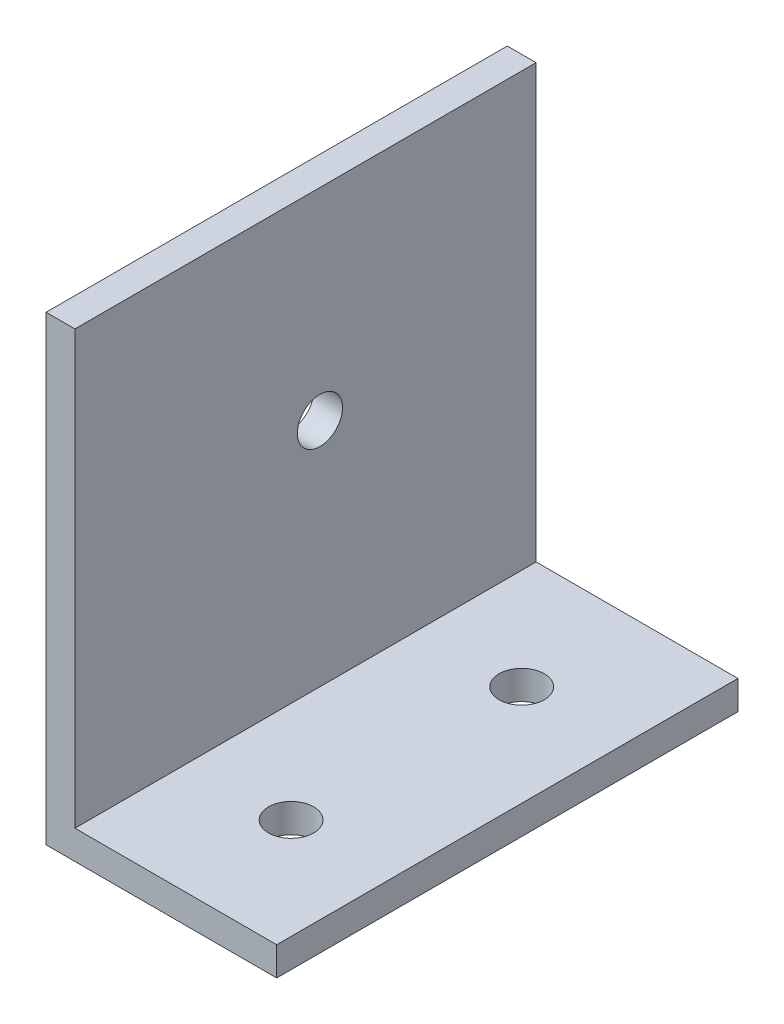
from build123d import *

# Parameters (mm, degrees)
BOSS_EXTRUDE1_DEPTH = 50.8
SKETCH2_R           = 2.4892
CUT_EXTRUDE1_DEPTH  = 77.2
SKETCH3_R           = 2.4892
CUT_EXTRUDE2_DEPTH  = 77.2


with BuildPart() as part:
    # Sketch1 → Boss-Extrude1 (new body)
    with BuildSketch(Plane.XY):
        Polygon((0, 0), (0, 50.8), (3.175, 50.8), (3.175, 3.175), (25.4, 3.175), (25.4, 0), align=None)
    extrude(amount=BOSS_EXTRUDE1_DEPTH)

    # Sketch2 → Cut-Extrude1 (cut, through all)
    with BuildSketch(Plane(origin=(0, 0, 0), x_dir=(0, 0, -1), z_dir=(1, 0, 0))):
        with Locations(Location((-23.8125, 28.575, 0), (0, 0, 270))):
            Circle(SKETCH2_R)
    extrude(amount=CUT_EXTRUDE1_DEPTH, mode=Mode.SUBTRACT)

    # Sketch3 → Cut-Extrude2 (cut, through all)
    with BuildSketch(Plane(origin=(0, 0, 0), x_dir=(1, 0, 0), z_dir=(0, 1, 0))):
        with Locations(Location((14.2875, -38.1, 0), (0, 0, 90))):
            Circle(SKETCH3_R)
        with Locations(Location((14.2875, -12.7, 0), (0, 0, 90))):
            Circle(SKETCH3_R)
    extrude(amount=CUT_EXTRUDE2_DEPTH, mode=Mode.SUBTRACT)


solid = part.part
